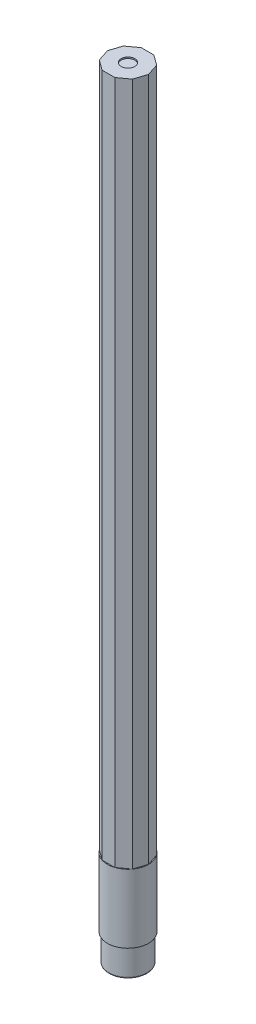
from build123d import *

# Parameters (mm, degrees)
SKETCH2_R           = 3.81
BOSS_EXTRUDE1_DEPTH = 12.7
BOSS_EXTRUDE2_DEPTH = 127
SKETCH4_R           = 3.556
BOSS_EXTRUDE3_DEPTH = 5.08
FILLET3_R           = 0.254
SKETCH5_R           = 1.27
CUT_EXTRUDE1_DEPTH  = 0.254


with BuildPart() as part:
    # Sketch2 → Boss-Extrude1 (new body)
    with BuildSketch(Plane(origin=(0, 0, 0), x_dir=(1, 0, 0), z_dir=(0, 1, 0))):
        with Locations(Location((0, 0, 0), (0, 0, 270))):
            Circle(SKETCH2_R)
    extrude(amount=BOSS_EXTRUDE1_DEPTH)

    # Sketch3 → Boss-Extrude2 (add)
    with BuildSketch(Plane(origin=(0, 12.7, 0), x_dir=(1, 0, 0), z_dir=(0, 1, 0))):
        Polygon((3.81, 0), (3.082354749, 2.239461811), (1.177354749, 3.623525327), (-1.177354749, 3.623525327), (-3.082354749, 2.239461811), (-3.81, 0), (-3.082354749, -2.239461811), (-1.177354749, -3.623525327), (1.177354749, -3.623525327), (3.082354749, -2.239461811), align=None)
    extrude(amount=BOSS_EXTRUDE2_DEPTH)

    # Sketch4 → Boss-Extrude3 (add)
    with BuildSketch(Plane.XZ):
        with Locations(Location((0, 0, 0), (0, 0, 270))):
            Circle(SKETCH4_R)
    extrude(amount=BOSS_EXTRUDE3_DEPTH)

    # Fillet3
    fillet3_edges = [part.edges().sort_by_distance(p)[0] for p in [
        (0, -5.08, 3.556),
    ]]
    fillet(fillet3_edges, radius=FILLET3_R)

    # Sketch5 → Cut-Extrude1 (cut)
    with BuildSketch(Plane(origin=(0, 139.7, 0), x_dir=(1, 0, 0), z_dir=(0, 1, 0))):
        with Locations(Location((0, 0, 0), (0, 0, 270))):
            Circle(SKETCH5_R)
    extrude(amount=-CUT_EXTRUDE1_DEPTH, mode=Mode.SUBTRACT)


solid = part.part
